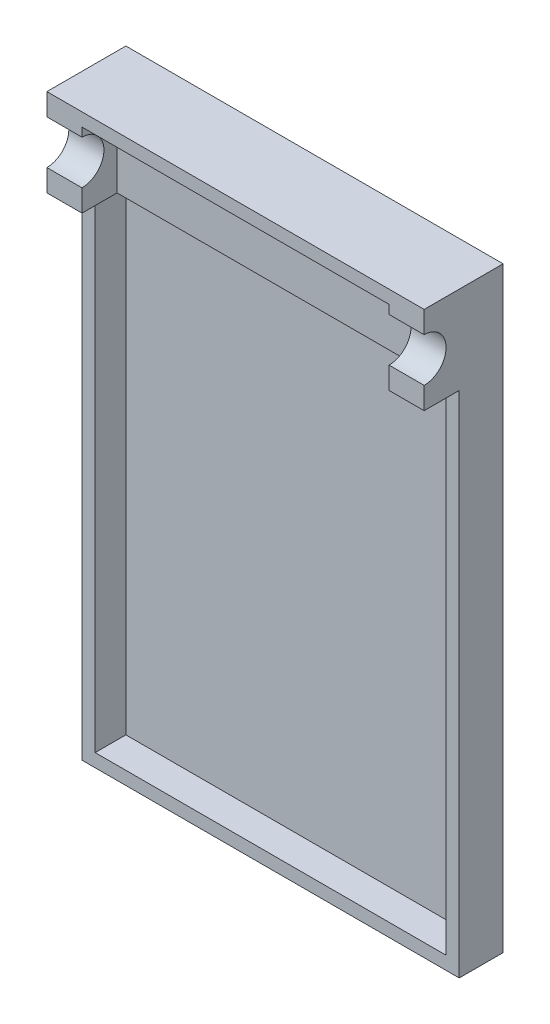
from build123d import *

# Parameters (mm, degrees)
IZIM1_W                     = 86
IZIM1_H                     = 136
IZIM1_W_2                   = 80
IZIM1_H_2                   = 130
Y_KSEKLIK_EKSTR_ZYON1_DEPTH = 10
IZIM1_2_W                   = 80
IZIM1_2_H                   = 130
Y_KSEKLIK_EKSTR_ZYON2_DEPTH = 3
Y_KSEKLIK_EKSTR_ZYON3_DEPTH = 86
KES_EKSTR_ZYON2_DEPTH       = 17
Y_KSEKLIK_EKSTR_ZYON4_REACH = 127.67


with BuildPart() as part:
    # Çizim1 → Yükseklik-Ekstrüzyon1 (new body)
    with BuildSketch(Plane.XY):
        with Locations((19.351242886, 24.627445339)):
            Rectangle(IZIM1_W, IZIM1_H)
        with Locations((19.351242886, 24.627445339)):
            Rectangle(IZIM1_W_2, IZIM1_H_2, mode=Mode.SUBTRACT)
    extrude(amount=Y_KSEKLIK_EKSTR_ZYON1_DEPTH)

    # Çizim1<2> → Yükseklik-Ekstrüzyon2 (add)
    with BuildSketch(Plane.XY):
        with Locations((19.351242886, 24.627445339)):
            Rectangle(IZIM1_2_W, IZIM1_2_H)
    extrude(amount=Y_KSEKLIK_EKSTR_ZYON2_DEPTH)

    # Çizim2 → Yükseklik-Ekstrüzyon3 (add, through all)
    with BuildSketch(Plane.ZY.offset(23.648757114)):
        with BuildLine():
            Line((18, 92.627445339), (10, 92.627445339))
            Line((10, 92.627445339), (10, 87.627445339))
            Line((10, 87.627445339), (10, 77.627445339))
            Line((10, 77.627445339), (10, 72.627445339))
            Line((10, 72.627445339), (18, 72.627445339))
            Line((18, 72.627445339), (18, 75.627445339))
            Line((18, 75.627445339), (18, 77.627445339))
            ThreePointArc((18, 77.627445339), (13, 82.627445339), (18, 87.627445339))
            Line((18, 87.627445339), (18, 89.627445339))
            Line((18, 89.627445339), (18, 92.627445339))
        make_face()
    extrude(amount=-Y_KSEKLIK_EKSTR_ZYON3_DEPTH)

    # Çizim5 → Kes-Ekstrüzyon2 (cut)
    with BuildSketch(Plane.XZ.offset(-72.627445339)):
        Polygon((-15.648757114, 10), (-15.648757114, 3), (54.351242886, 3), (54.351242886, 10), (54.351242886, 18), (-15.648757114, 18), align=None)
    extrude(amount=-KES_EKSTR_ZYON2_DEPTH, mode=Mode.SUBTRACT)

    # Yükseklik-Ekstrüzyon4: up to this face of the body (flat: up to its plane)
    y_kseklik_ekstr_zyon4_end = Plane(part.part.faces().sort_by_distance((59.351242886, 24.627445339, 6.5))[0])
    # Çizim6 → Yükseklik-Ekstrüzyon4 (add, up to the picked face)
    with BuildSketch(Plane(origin=(-20.648757114, 0, 0), x_dir=(0, 0, -1), z_dir=(1, 0, 0)), mode=Mode.PRIVATE) as y_kseklik_ekstr_zyon4_sk1:
        Polygon((-10, 72.627445339), (0, 82.627445339), (0, 92.627445339), (-10, 92.627445339), align=None)
    y_kseklik_ekstr_zyon4_tool1 = split(extrude(y_kseklik_ekstr_zyon4_sk1.sketch, amount=Y_KSEKLIK_EKSTR_ZYON4_REACH, mode=Mode.PRIVATE), bisect_by=y_kseklik_ekstr_zyon4_end, keep=Keep.BOTH, mode=Mode.PRIVATE)
    add(y_kseklik_ekstr_zyon4_tool1.solids().sort_by(Axis((-20.648757, 84.849668, 5.555556), (1, 0, 0)))[0])


solid = part.part
